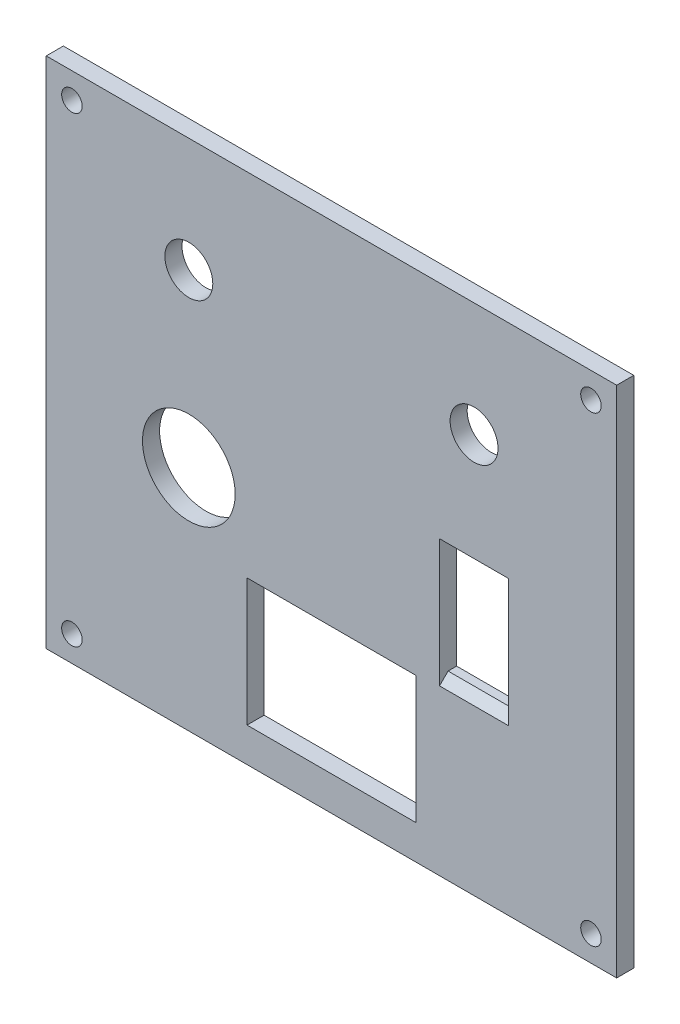
from build123d import *

# Parameters (mm, degrees)
SKETCH1_W            = 100
SKETCH1_H            = 90
SKETCH1_R            = 4.2
SKETCH1_R_2          = 8.125
SKETCH1_W_2          = 29.6
SKETCH1_H_2          = 22.35
SKETCH1_W_3          = 12.1
SKETCH1_H_3          = 19.35
BOSS_EXTRUDE1_DEPTH  = 3
M3_CLEARANCE_HOLE1_D = 3.6
MIRROR2_COPY_1_D     = 3.6
CHAMFER1_SIZE        = 1.5


with BuildPart() as part:
    # Sketch1 → Boss-Extrude1 (new body)
    with BuildSketch(Plane.XY):
        Rectangle(SKETCH1_W, SKETCH1_H)
        with Locations((25, 25)):
            Circle(SKETCH1_R, mode=Mode.SUBTRACT)
        with Locations((-25, 25)):
            Circle(SKETCH1_R, mode=Mode.SUBTRACT)
        with Locations((-25, -5)):
            Circle(SKETCH1_R_2, mode=Mode.SUBTRACT)
        with Locations((0, -27.825)):
            Rectangle(SKETCH1_W_2, SKETCH1_H_2, mode=Mode.SUBTRACT)
        with Locations((25, -5)):
            Rectangle(SKETCH1_W_3, SKETCH1_H_3, mode=Mode.SUBTRACT)
    extrude(amount=BOSS_EXTRUDE1_DEPTH)

    # M3 Clearance Hole1 (through all)
    with Locations(Plane.XY.offset(3)):
        with Locations((-45.5, 40.5)):
            m3_clearance_hole1 = Hole(M3_CLEARANCE_HOLE1_D / 2)

    # Mirror1: M3 Clearance Hole1 across plane
    add(m3_clearance_hole1.mirror(Plane.ZX), mode=Mode.SUBTRACT)

    # Mirror2: M3 Clearance Hole1 across plane
    add(m3_clearance_hole1.mirror(Plane(origin=(0, 0, 0), x_dir=(0, 0, 1), z_dir=(1, 0, 0))), mode=Mode.SUBTRACT)

    # Mirror2 copy 1 (through all)
    with Locations(Plane(origin=(0, 0, 3), x_dir=(-1, 0, 0), z_dir=(0, 0, 1))):
        with Locations((-45.5, 40.5)):
            Hole(MIRROR2_COPY_1_D / 2)

    # Chamfer1
    chamfer1_edges = [part.edges().sort_by_distance(p)[0] for p in [
        (25, 4.675, 3),
        (25, -14.675, 3),
    ]]
    chamfer(chamfer1_edges, length=CHAMFER1_SIZE)


solid = part.part
